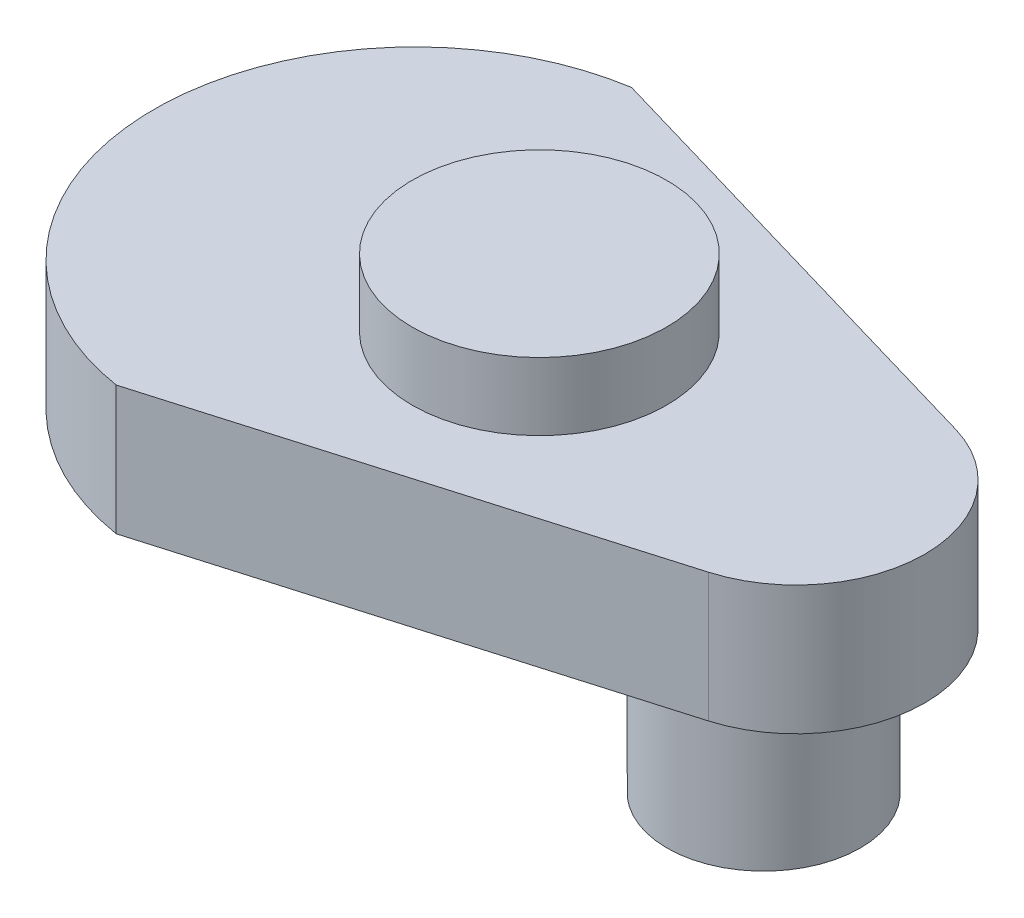
from build123d import *

# Parameters (mm, degrees)
BOSS_EXTRUDE9_DEPTH  = 10
FILLET8_R            = 10
BOSS_EXTRUDE10_DEPTH = 5
SKETCH12_R           = 7.5
BOSS_EXTRUDE11_DEPTH = 12.5
SKETCH14_R           = 9.875
BOSS_EXTRUDE12_DEPTH = 0.25
CUT_EXTRUDE1_START   = -0.25
SKETCH15_R           = 7.5
CUT_EXTRUDE1_DEPTH   = 0.25
CUT_EXTRUDE2_START   = -12
SKETCH18_R           = 7.5
CUT_EXTRUDE2_DEPTH   = 12
SKETCH19_R           = 7.5
BOSS_EXTRUDE13_DEPTH = 12


with BuildPart() as part:
    # Sketch8 → Boss-Extrude9 (new body)
    with BuildSketch(Plane(origin=(0, 0, 0), x_dir=(1, 0, 0), z_dir=(0, 1, 0))):
        Polygon((17.063256467, 20), (17.063256467, 0), (85.43, 0), align=None)
        with BuildLine():
            ThreePointArc((17.063256467, 20), (4.845449314, 13.144910814), (0, 0))
            Line((0, 0), (17.063256467, 0))
            Line((17.063256467, 0), (17.063256467, 20))
        make_face()
        with BuildLine():
            Line((17.063256467, 0), (0, 0))
            ThreePointArc((0, 0), (4.845449314, -13.144910814), (17.063256467, -20))
            Line((17.063256467, -20), (17.063256467, 0))
        make_face()
        Polygon((85.43, 0), (17.063256467, 0), (17.063256467, -20), align=None)
    extrude(amount=BOSS_EXTRUDE9_DEPTH)

    # Fillet8
    fillet8_edges = [part.edges().sort_by_distance(p)[0] for p in [
        (85.43, 5, 0),
    ]]
    fillet(fillet8_edges, radius=FILLET8_R)

    # Sketch11 → Boss-Extrude10 (add)
    with BuildSketch(Plane(origin=(0, 10, 0), x_dir=(1, 0, 0), z_dir=(0, 1, 0))):
        with BuildLine():
            Line((20.031975788, 0), (29.906975788, 0))
            Line((29.906975788, 0), (39.781975788, 0))
            ThreePointArc((39.781975788, 0), (29.906975788, 9.875), (20.031975788, 0))
        make_face()
        with BuildLine():
            Line((39.781975788, 0), (29.906975788, 0))
            Line((29.906975788, 0), (20.031975788, 0))
            ThreePointArc((20.031975788, 0), (29.906975788, -9.875), (39.781975788, 0))
        make_face()
    extrude(amount=BOSS_EXTRUDE10_DEPTH)

    # Sketch12 → Boss-Extrude11 (add)
    with BuildSketch(Plane.XZ):
        with Locations(Location((47.313951576, 0, 0), (0, 0, 90))):
            Circle(SKETCH12_R)
    extrude(amount=BOSS_EXTRUDE11_DEPTH)

    # Sketch14 → Boss-Extrude12 (add)
    with BuildSketch(Plane(origin=(0, 15, 0), x_dir=(1, 0, 0), z_dir=(0, 1, 0))):
        with Locations(Location((29.906975788, 0, 0), (0, 0, 270))):
            Circle(SKETCH14_R)
    extrude(amount=BOSS_EXTRUDE12_DEPTH)

    # Sketch15 → Cut-Extrude1 (cut)
    with BuildSketch(Plane.XZ.offset(12.5).offset(CUT_EXTRUDE1_START)):
        with Locations(Location((47.313951576, 0, 0), (0, 0, 90))):
            Circle(SKETCH15_R)
    extrude(amount=CUT_EXTRUDE1_DEPTH, mode=Mode.SUBTRACT)

    # Sketch18 → Cut-Extrude2 (cut)
    with BuildSketch(Plane.XZ.offset(12.25).offset(CUT_EXTRUDE2_START)):
        with Locations(Location((47.313951576, 0, 0), (0, 0, 90))):
            Circle(SKETCH18_R)
    extrude(amount=CUT_EXTRUDE2_DEPTH, mode=Mode.SUBTRACT)

    # Sketch19 → Boss-Extrude13 (add)
    with BuildSketch(Plane.XZ.offset(0.25)):
        with Locations(Location((47.313951576, 0, 0), (0, 0, 90))):
            Circle(SKETCH19_R)
    extrude(amount=BOSS_EXTRUDE13_DEPTH)


solid = part.part
